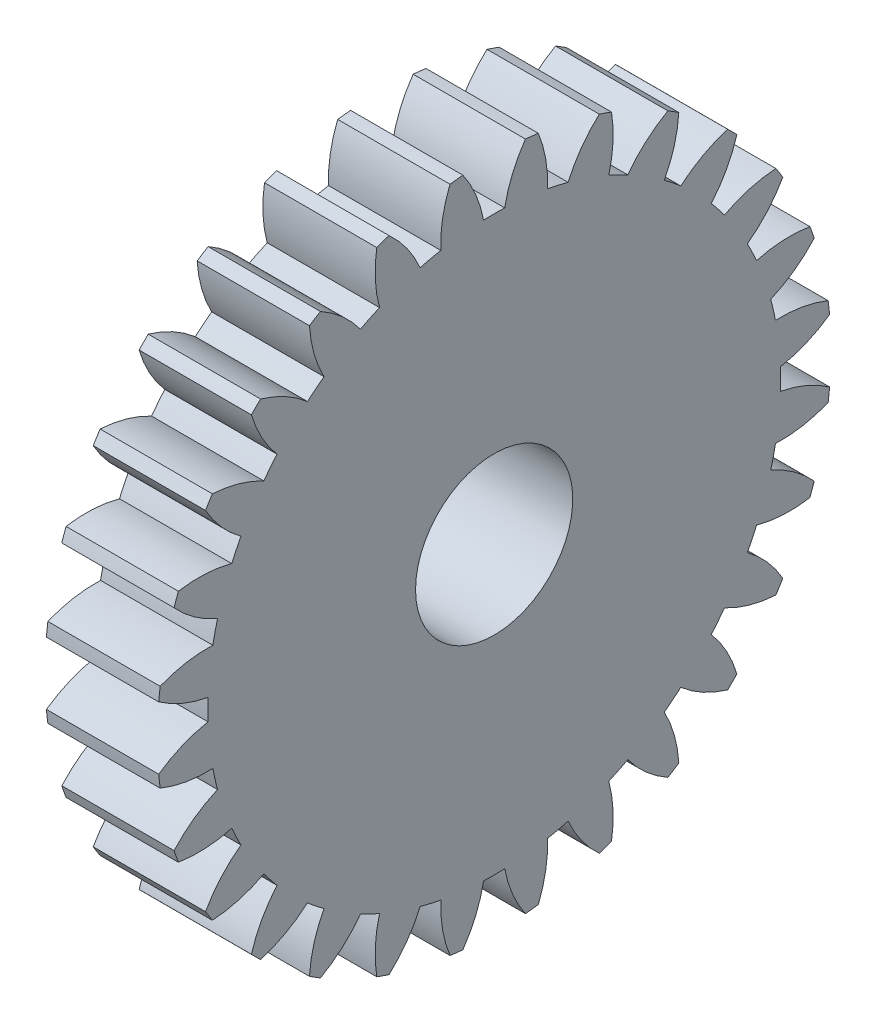
from build123d import *

# Parameters (mm, degrees)
BASPROSKE_W     = 5
BASPROSKE_H     = 15
TOOTHCUT_DEPTH  = 22.794494718
TEETHCUTS_COUNT = 28
TEETHCUTS_ANGLE = 347.142857143
BORSKE_R        = 3.5
BORE_DEPTH      = 50.0000508


with BuildPart() as part:
    # BasProSke → Base-Revolve (revolve)
    with BuildSketch(Plane(origin=(0, 0, 0), x_dir=(1, 0, 0), z_dir=(0, 1, 0)), mode=Mode.PRIVATE) as base_revolve_sk:
        with Locations((2.5, 7.5)):
            Rectangle(BASPROSKE_W, BASPROSKE_H)
    revolve(base_revolve_sk.sketch.rotate(Axis((-10, 0, 0), (1, 0, 0)), 180), axis=Axis((-10, 0, 0), (1, 0, 0)))

    # TooCutSke → ToothCut (cut, through all)
    with BuildSketch(Plane(origin=(0, 0, 0), x_dir=(0, 0, -1), z_dir=(1, 0, 0))):
        with BuildLine():
            ThreePointArc((0.471336039, 12.740284272), (0, 12.749), (-0.471336039, 12.740284272))
            ThreePointArc((-0.471336039, 12.740284272), (-0.81983923, 13.900763331), (-1.409805137, 14.959114099))
            ThreePointArc((-1.409805137, 14.959114099), (0, 15.0254), (1.409805137, 14.959114099))
            ThreePointArc((1.409805137, 14.959114099), (0.81983923, 13.900763331), (0.471336039, 12.740284272))
        make_face()
    toothcut = extrude(amount=TOOTHCUT_DEPTH, mode=Mode.SUBTRACT)

    # TeethCuts: ToothCut ×28 about axis
    teethcuts_axis = Axis((-10, 0, 0), (1, 0, 0))
    for i in range(1, TEETHCUTS_COUNT):
        add(toothcut.rotate(teethcuts_axis, i * TEETHCUTS_ANGLE / (TEETHCUTS_COUNT - 1)), mode=Mode.SUBTRACT)

    # BorSke → Bore (cut, symmetric)
    with BuildSketch(Plane(origin=(0, 0, 0), x_dir=(0, 0, -1), z_dir=(1, 0, 0))):
        with Locations(Location((0, 0, 0), (0, 0, 180))):
            Circle(BORSKE_R)
    extrude(amount=BORE_DEPTH, both=True, mode=Mode.SUBTRACT)


solid = part.part
